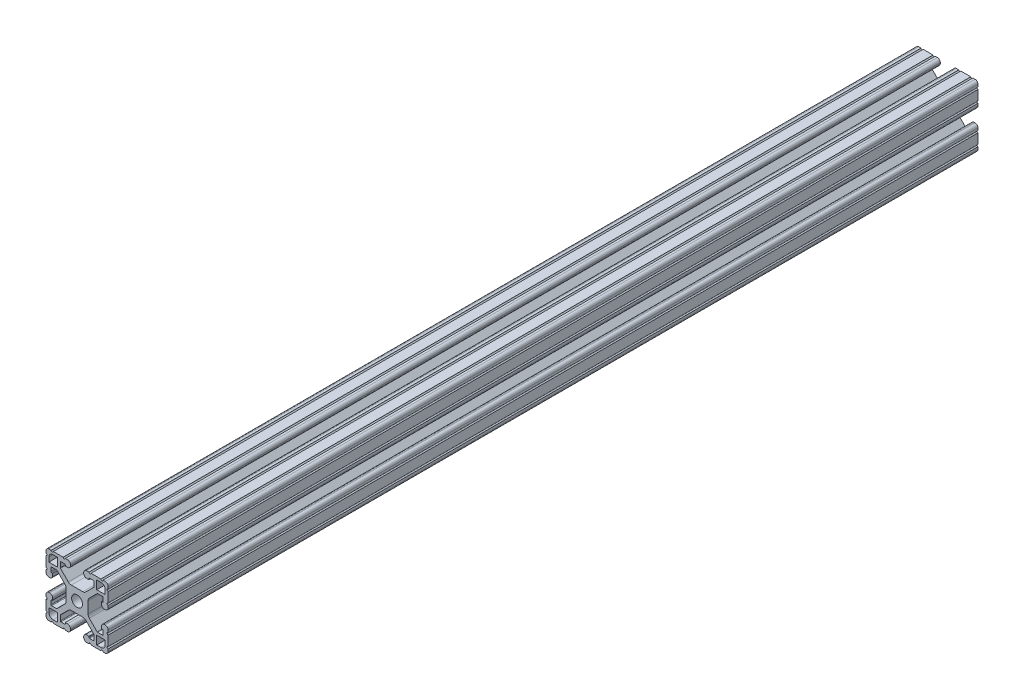
from build123d import *

# Parameters (mm, degrees)
BOSS_EXTRUDE1_DEPTH      = 266.7
BOSS_EXTRUDE1_DEPTH_BACK = 266.7
SKETCH3_W                = 38.1
SKETCH3_H                = 38.1
SKETCH4_W                = 5.207
SKETCH4_H                = 5.207
SKETCH4_R                = 3.3274
CUT_EXTRUDE1_DEPTH       = 535.079923794
CUT_EXTRUDE2_DEPTH       = 535.079923794
FILLET1_R                = 2.54
FILLET2_R                = 1.778
FILLET3_R                = 0.396875


with BuildPart() as part:
    # Sketch3 → Boss-Extrude1 (new, two sides: drawn at the far end of the back side and taken through both)
    with BuildSketch(Plane.XY.offset(-BOSS_EXTRUDE1_DEPTH_BACK)):
        Rectangle(SKETCH3_W, SKETCH3_H)
    extrude(amount=BOSS_EXTRUDE1_DEPTH + BOSS_EXTRUDE1_DEPTH_BACK)

    # Sketch4 → Cut-Extrude1 (cut, through all)
    with BuildSketch(Plane.XY.offset(266.7)):
        Polygon((7.239, 14.986), (4.064, 14.986), (4.064, 19.05), (-4.064, 19.05), (-4.064, 14.986), (-7.239, 14.986), (-7.239, 16.002), (-10.287, 16.002), (-10.287, 12.442261469), (-4.601138531, 6.7564), (4.601138531, 6.7564), (10.287, 12.442261469), (10.287, 16.002), (7.239, 16.002), align=None)
        Polygon((10.287, -12.442261469), (4.601138531, -6.7564), (-4.601138531, -6.7564), (-10.287, -12.442261469), (-10.287, -16.002), (-7.239, -16.002), (-7.239, -14.986), (-4.064, -14.986), (-4.064, -19.05), (4.064, -19.05), (4.064, -14.986), (7.239, -14.986), (7.239, -16.002), (10.287, -16.002), align=None)
        Polygon((-12.442261469, -10.287), (-6.7564, -4.601138531), (-6.7564, 4.601138531), (-12.442261469, 10.287), (-16.002, 10.287), (-16.002, 7.239), (-14.986, 7.239), (-14.986, 4.064), (-19.05, 4.064), (-19.05, -4.064), (-14.986, -4.064), (-14.986, -7.239), (-16.002, -7.239), (-16.002, -10.287), align=None)
        Polygon((14.986, -7.239), (14.986, -4.064), (19.05, -4.064), (19.05, 4.064), (14.986, 4.064), (14.986, 7.239), (16.002, 7.239), (16.002, 10.287), (12.442261469, 10.287), (6.7564, 4.601138531), (6.7564, -4.601138531), (12.442261469, -10.287), (16.002, -10.287), (16.002, -7.239), align=None)
        with Locations((14.6685, 14.6685)):
            Rectangle(SKETCH4_W, SKETCH4_H)
        with Locations((14.6685, -14.6685)):
            Rectangle(SKETCH4_W, SKETCH4_H)
        with Locations((-14.6685, 14.6685)):
            Rectangle(SKETCH4_W, SKETCH4_H)
        with Locations((-14.6685, -14.6685)):
            Rectangle(SKETCH4_W, SKETCH4_H)
        Circle(SKETCH4_R)
    extrude(amount=-CUT_EXTRUDE1_DEPTH, mode=Mode.SUBTRACT)

    # Sketch5 → Cut-Extrude2 (cut, through all)
    with BuildSketch(Plane.XY.offset(266.7)):
        with BuildLine():
            Line((-14.605, 19.05), (-15.875, 19.05))
            ThreePointArc((-15.875, 19.05), (-15.24, 18.415), (-14.605, 19.05))
        make_face()
        with BuildLine():
            Line((-7.239, 19.05), (-8.509, 19.05))
            ThreePointArc((-8.509, 19.05), (-7.874, 18.415), (-7.239, 19.05))
        make_face()
        with BuildLine():
            ThreePointArc((-19.05, 14.605), (-18.415, 15.24), (-19.05, 15.875))
            Line((-19.05, 15.875), (-19.05, 14.605))
        make_face()
        with BuildLine():
            ThreePointArc((-19.05, 7.239), (-18.415, 7.874), (-19.05, 8.509))
            Line((-19.05, 8.509), (-19.05, 7.239))
        make_face()
        with BuildLine():
            ThreePointArc((7.239, 19.05), (7.874, 18.415), (8.509, 19.05))
            Line((8.509, 19.05), (7.239, 19.05))
        make_face()
        with BuildLine():
            ThreePointArc((14.605, 19.05), (15.24, 18.415), (15.875, 19.05))
            Line((15.875, 19.05), (14.605, 19.05))
        make_face()
        with BuildLine():
            Line((19.05, 14.605), (19.05, 15.875))
            ThreePointArc((19.05, 15.875), (18.415, 15.24), (19.05, 14.605))
        make_face()
        with BuildLine():
            Line((19.05, 7.239), (19.05, 8.509))
            ThreePointArc((19.05, 8.509), (18.415, 7.874), (19.05, 7.239))
        make_face()
        with BuildLine():
            ThreePointArc((19.05, -7.239), (18.415, -7.874), (19.05, -8.509))
            Line((19.05, -8.509), (19.05, -7.239))
        make_face()
        with BuildLine():
            ThreePointArc((19.05, -14.605), (18.415, -15.24), (19.05, -15.875))
            Line((19.05, -15.875), (19.05, -14.605))
        make_face()
        with BuildLine():
            Line((14.605, -19.05), (15.875, -19.05))
            ThreePointArc((15.875, -19.05), (15.24, -18.415), (14.605, -19.05))
        make_face()
        with BuildLine():
            Line((7.239, -19.05), (8.509, -19.05))
            ThreePointArc((8.509, -19.05), (7.874, -18.415), (7.239, -19.05))
        make_face()
        with BuildLine():
            ThreePointArc((-7.239, -19.05), (-7.874, -18.415), (-8.509, -19.05))
            Line((-8.509, -19.05), (-7.239, -19.05))
        make_face()
        with BuildLine():
            ThreePointArc((-14.605, -19.05), (-15.24, -18.415), (-15.875, -19.05))
            Line((-15.875, -19.05), (-14.605, -19.05))
        make_face()
        with BuildLine():
            Line((-19.05, -14.605), (-19.05, -15.875))
            ThreePointArc((-19.05, -15.875), (-18.415, -15.24), (-19.05, -14.605))
        make_face()
        with BuildLine():
            Line((-19.05, -7.239), (-19.05, -8.509))
            ThreePointArc((-19.05, -8.509), (-18.415, -7.874), (-19.05, -7.239))
        make_face()
    extrude(amount=-CUT_EXTRUDE2_DEPTH, mode=Mode.SUBTRACT)

    # Fillet1
    fillet1_edges = [part.edges().sort_by_distance(p)[0] for p in [
        (6.7564, -4.601138531, 0),
        (6.7564, 4.601138531, 0),
        (-17.272, 17.272, 0),
        (-17.272, -17.272, 0),
        (17.272, -17.272, 0),
        (17.272, 17.272, 0),
        (-4.601138531, -6.7564, 0),
        (4.601138531, -6.7564, 0),
        (-6.7564, 4.601138531, 0),
        (-6.7564, -4.601138531, 0),
        (4.601138531, 6.7564, 0),
        (-4.601138531, 6.7564, 0),
    ]]
    fillet(fillet1_edges, radius=FILLET1_R)

    # Fillet2
    fillet2_edges = [part.edges().sort_by_distance(p)[0] for p in [
        (14.986, 4.064, 0),
        (19.05, 4.064, 0),
        (19.05, -4.064, 0),
        (14.986, -4.064, 0),
        (4.064, -14.986, 0),
        (4.064, -19.05, 0),
        (-4.064, -19.05, 0),
        (-4.064, -14.986, 0),
        (-14.986, -4.064, 0),
        (-19.05, -4.064, 0),
        (-19.05, 4.064, 0),
        (-14.986, 4.064, 0),
        (-19.05, 19.05, 0),
        (19.05, 19.05, 0),
        (19.05, -19.05, 0),
        (-19.05, -19.05, 0),
        (-4.064, 14.986, 0),
        (-4.064, 19.05, 0),
        (4.064, 19.05, 0),
        (4.064, 14.986, 0),
    ]]
    fillet(fillet2_edges, radius=FILLET2_R)

    # Fillet3
    fillet3_edges = [part.edges().sort_by_distance(p)[0] for p in [
        (12.442261469, 10.287, 0),
        (16.002, 10.287, 0),
        (16.002, 7.239, 0),
        (16.002, -7.239, 0),
        (16.002, -10.287, 0),
        (12.442261469, -10.287, 0),
        (-7.239, -16.002, 0),
        (-10.287, -16.002, 0),
        (-10.287, -12.442261469, 0),
        (10.287, -12.442261469, 0),
        (10.287, -16.002, 0),
        (7.239, -16.002, 0),
        (-16.002, 7.239, 0),
        (-16.002, 10.287, 0),
        (-12.442261469, 10.287, 0),
        (-12.442261469, -10.287, 0),
        (-16.002, -10.287, 0),
        (-14.986, -7.239, 0),
        (-10.287, 12.442261469, 0),
        (-10.287, 16.002, 0),
        (-7.239, 16.002, 0),
        (7.239, 16.002, 0),
        (10.287, 16.002, 0),
        (10.287, 12.442261469, 0),
    ]]
    fillet(fillet3_edges, radius=FILLET3_R)


solid = part.part
